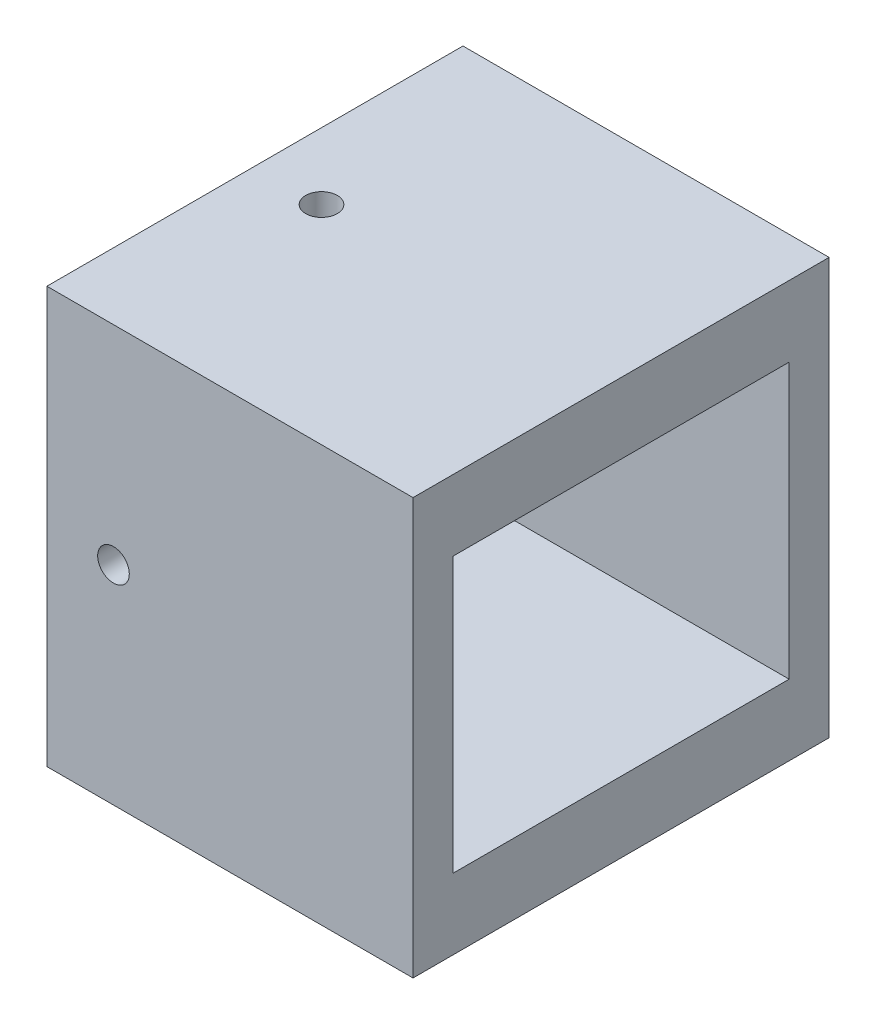
from build123d import *

# Parameters (mm, degrees)
SKETCH_1_W          = 25
SKETCH_1_H          = 25
SKETCH_1_W_2        = 20.2
SKETCH_1_H_2        = 16.5
EXTRUDE_1_DEPTH     = 20
SKETCH_1_3_W        = 25
SKETCH_1_3_H        = 25
EXTRUDE_3_DEPTH     = 2
SKETCH_1_5_R        = 0.5
CUT_EXTRUDE_1_DEPTH = 0.1
SKETCH_2_R          = 0.95
CUT_EXTRUDE_2_DEPTH = 4
SKETCH_3_R          = 0.95
CUT_EXTRUDE_3_DEPTH = 4
CUT_EXTRUDE_START   = -4
SKETCH_4_R          = 0.95
CUT_EXTRUDE_4_DEPTH = 4
SKETCH_5_R          = 0.95
CUT_EXTRUDE_5_DEPTH = 4
SKETCH_6_R          = 0.75
CUT_EXTRUDE_6_DEPTH = 2


with BuildPart() as part:
    # 草图1 → 凸台-拉伸1 (new body)
    with BuildSketch(Plane(origin=(0, 0, 0), x_dir=(0, 0, -1), z_dir=(1, 0, 0))):
        Rectangle(SKETCH_1_W, SKETCH_1_H)
        Rectangle(SKETCH_1_W_2, SKETCH_1_H_2, mode=Mode.SUBTRACT)
    extrude(amount=EXTRUDE_1_DEPTH)

    # 草图1<3> → 凸台-拉伸3 (add)
    with BuildSketch(Plane(origin=(0, 0, 0), x_dir=(0, 0, -1), z_dir=(1, 0, 0))):
        Rectangle(SKETCH_1_3_W, SKETCH_1_3_H)
    extrude(amount=-EXTRUDE_3_DEPTH)

    # 草图1<5> → 切除-拉伸1 (cut)
    with BuildSketch(Plane(origin=(0, 0, 0), x_dir=(0, 0, -1), z_dir=(1, 0, 0))):
        Circle(SKETCH_1_5_R)
    extrude(amount=-CUT_EXTRUDE_1_DEPTH, mode=Mode.SUBTRACT)

    # 草图2 → 切除-拉伸2 (cut)
    with BuildSketch(Plane.XZ.offset(12.5)):
        with Locations(Location((2, 0, 0), (0, 0, 270))):
            Circle(SKETCH_2_R)
    extrude(amount=-CUT_EXTRUDE_2_DEPTH, mode=Mode.SUBTRACT)

    # 草图3 → 切除-拉伸3 (cut)
    with BuildSketch(Plane(origin=(0, 0, -12.5), x_dir=(-1, 0, 0), z_dir=(0, 0, -1))):
        with Locations((-2, 0)):
            Circle(SKETCH_3_R)
    extrude(amount=-CUT_EXTRUDE_3_DEPTH, mode=Mode.SUBTRACT)

    # 草图4 → 切除-拉伸4 (cut)
    with BuildSketch(Plane(origin=(0, 12.5, 0), x_dir=(1, 0, 0), z_dir=(0, 1, 0)).offset(CUT_EXTRUDE_START)):
        with Locations(Location((2, 0, 0), (0, 0, 90))):
            Circle(SKETCH_4_R)
    extrude(amount=CUT_EXTRUDE_4_DEPTH, mode=Mode.SUBTRACT)

    # 草图5 → 切除-拉伸5 (cut)
    with BuildSketch(Plane.XY.offset(12.5).offset(CUT_EXTRUDE_START)):
        with Locations(Location((2, 0, 0), (0, 0, 180))):
            Circle(SKETCH_5_R)
    extrude(amount=CUT_EXTRUDE_5_DEPTH, mode=Mode.SUBTRACT)

    # 草图6 → 切除-拉伸6 (cut)
    with BuildSketch(Plane.ZY.offset(2)):
        with Locations((-6.1, 0)):
            Circle(SKETCH_6_R)
        with Locations((6.1, 0)):
            Circle(SKETCH_6_R)
    extrude(amount=-CUT_EXTRUDE_6_DEPTH, mode=Mode.SUBTRACT)


solid = part.part
